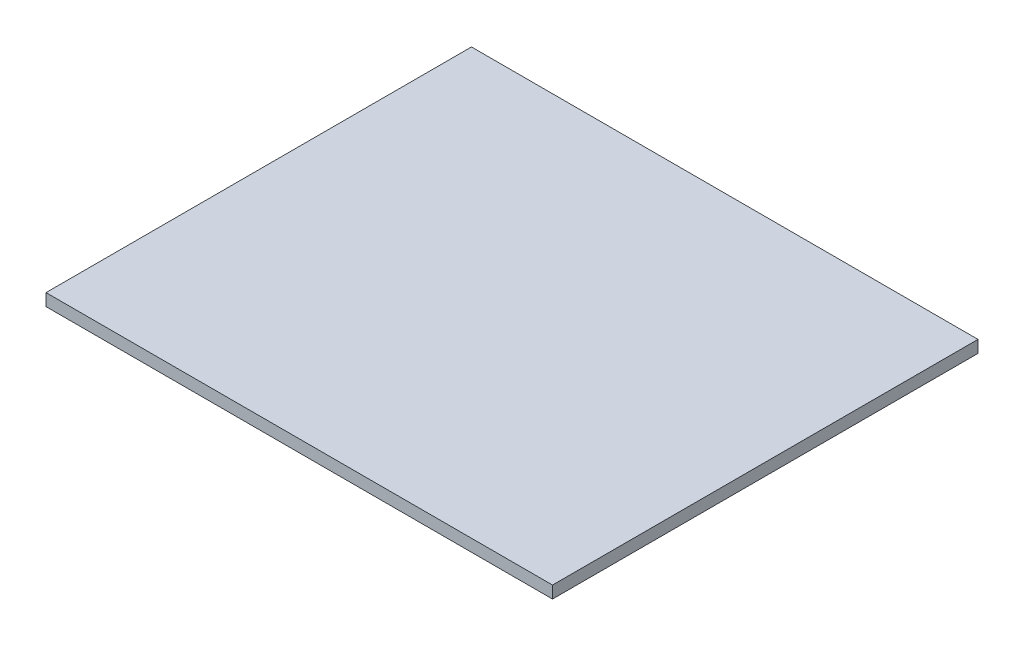
from build123d import *

# Parameters (mm, degrees)
SKETCH1_W           = 125
SKETCH1_H           = 105
BOSS_EXTRUDE1_DEPTH = 3


with BuildPart() as part:
    # Sketch1 → Boss-Extrude1 (new body)
    with BuildSketch(Plane(origin=(0, 0, 0), x_dir=(1, 0, 0), z_dir=(0, 1, 0))):
        with Locations((0, -22.5)):
            Rectangle(SKETCH1_W, SKETCH1_H)
    extrude(amount=BOSS_EXTRUDE1_DEPTH)


solid = part.part
